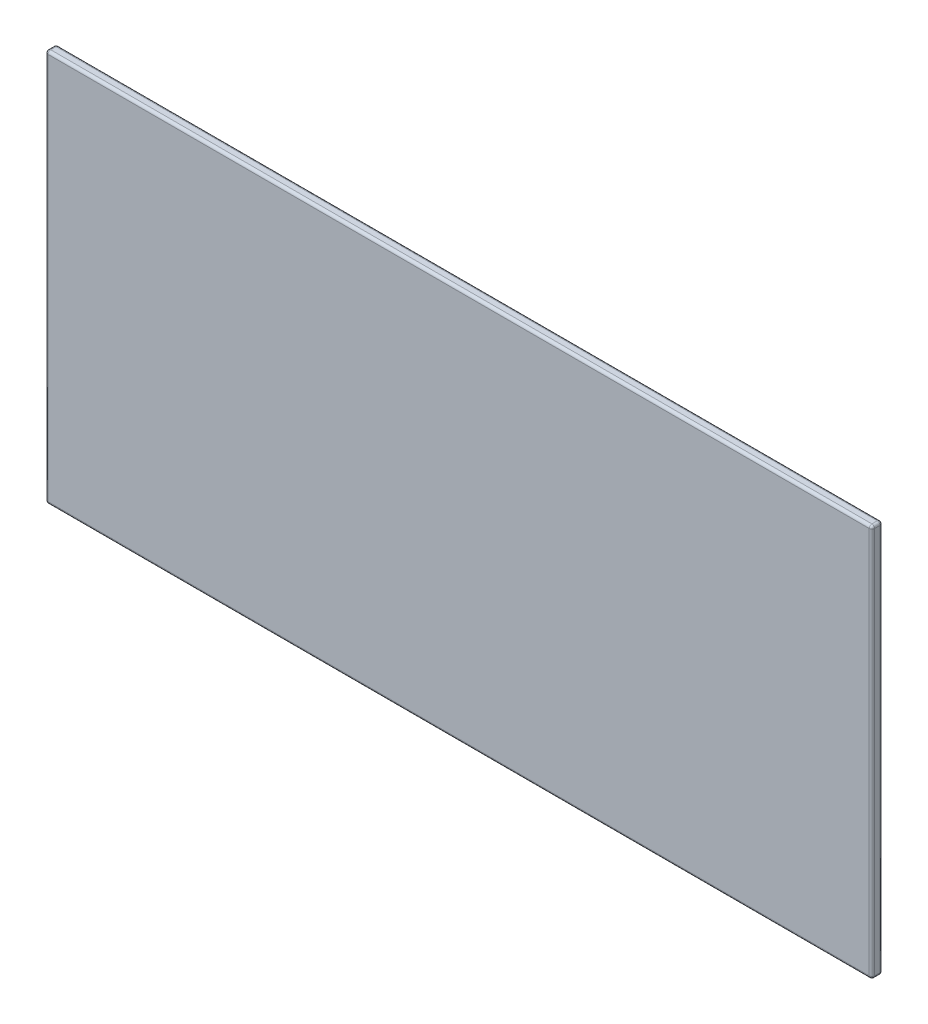
from build123d import *

# Parameters (mm, degrees)
SKETCH1_W           = 154.7
SKETCH1_H           = 73.5
BOSS_EXTRUDE1_DEPTH = 2
FILLET1_R           = 0.5


with BuildPart() as part:
    # Sketch1 → Boss-Extrude1 (new body)
    with BuildSketch(Plane.XY):
        Rectangle(SKETCH1_W, SKETCH1_H)
    extrude(amount=BOSS_EXTRUDE1_DEPTH)

    # Fillet1
    fillet1_edges = [part.edges().sort_by_distance(p)[0] for p in [
        (-77.35, 0, 2),
        (0, -36.75, 2),
        (77.35, 0, 2),
        (0, -36.75, 0),
        (-77.35, 0, 0),
        (0, 36.75, 0),
        (77.35, 0, 0),
        (77.35, -36.75, 1),
        (-77.35, -36.75, 1),
        (-77.35, 36.75, 1),
        (77.35, 36.75, 1),
        (0, 36.75, 2),
    ]]
    fillet(fillet1_edges, radius=FILLET1_R)


solid = part.part
